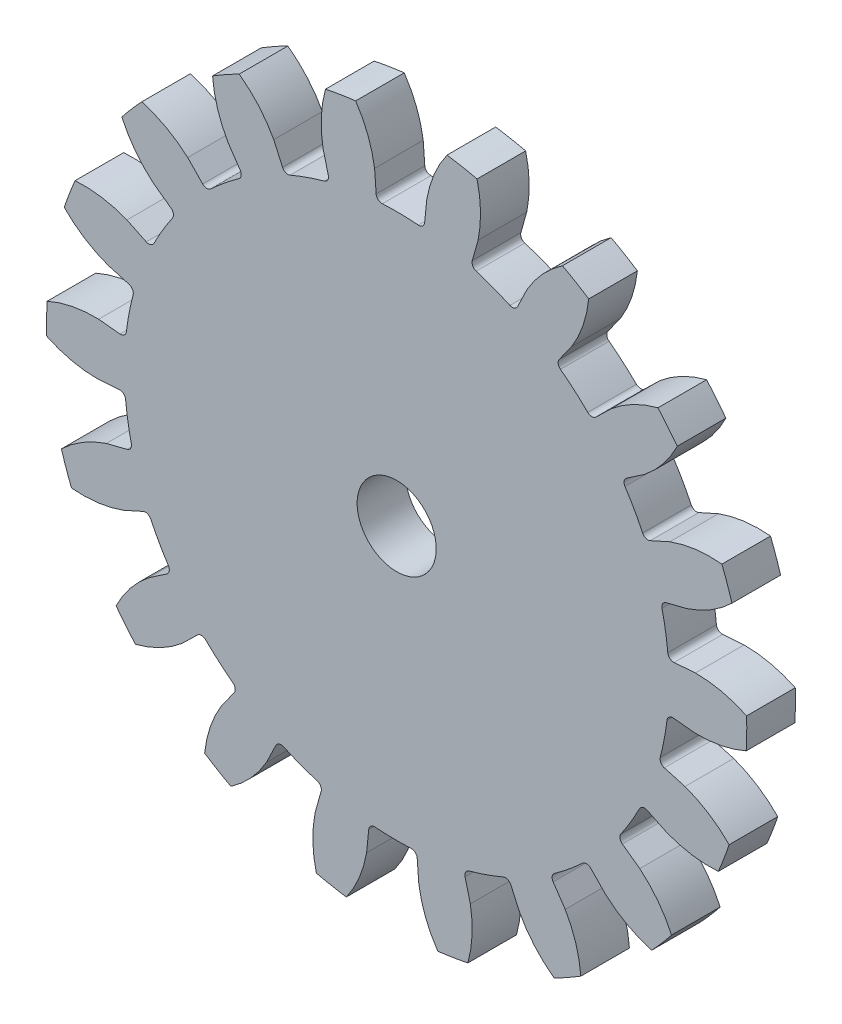
from build123d import *

# Parameters (mm, degrees)
BOSS_EXTRUDE1_DEPTH      = 3.175
FILLET1_R                = 0.381
CIRPATTERN1_COUNT        = 18
CIRPATTERN1_ANGLE        = 340
FILLET1_OF_CIRPATTERN1_R = 0.381
SKETCH2_R                = 2.5828
CUT_EXTRUDE1_DEPTH       = 33.368422922


with BuildPart() as part:
    # Sketch1 → Boss-Extrude1 (new body)
    with BuildSketch(Plane.XY):
        with BuildLine():
            Line((17.834748515, 8.02727285), (16.213407741, 7.297520773))
            ThreePointArc((16.213407741, 7.297520773), (15.879662784, 7.997794063), (15.515689986, 8.682843098))
            Line((15.515689986, 8.682843098), (0, 0))
            Line((0, 0), (17.549686627, 2.852525073))
            ThreePointArc((17.549686627, 2.852525073), (17.408557818, 3.615316681), (17.23429083, 4.371226327))
            Line((17.23429083, 4.371226327), (18.957719912, 4.80834896))
            ThreePointArc((18.957719912, 4.80834896), (20.523535103, 5.528199732), (21.888512952, 6.580244321))
            ThreePointArc((21.888512952, 6.580244321), (21.580653712, 7.528744912), (21.23171447, 8.462914109))
            ThreePointArc((21.23171447, 8.462914109), (19.508542384, 8.437609818), (17.834748515, 8.02727285))
        make_face()
    boss_extrude1 = extrude(amount=BOSS_EXTRUDE1_DEPTH)

    # Fillet1
    fillet1_edges = [part.edges().sort_by_distance(p)[0] for p in [
        (16.213407741, 7.297520773, 1.5875),
        (17.23429083, 4.371226327, 1.5875),
    ]]
    fillet(fillet1_edges, radius=FILLET1_R)

    # CirPattern1: Boss-Extrude1 ×18 about axis
    cirpattern1_axis = Axis((0, 0, 0), (0, 0, -1))
    for i in range(1, CIRPATTERN1_COUNT):
        add(boss_extrude1.rotate(cirpattern1_axis, i * CIRPATTERN1_ANGLE / (CIRPATTERN1_COUNT - 1)))

    # Fillet1 of CirPattern1
    fillet1_of_cirpattern1_edges = [part.edges().sort_by_distance(p)[0] for p in [
        (17.731518712, 1.312114381, 1.5875),
        (17.689983372, -1.786865496, 1.5875),
        (17.110946838, -4.83155237, 1.5875),
        (16.012002843, -7.729434969, 1.5875),
        (14.426542245, -10.392462599, 1.5875),
        (12.40273846, -12.739720511, 1.5875),
        (10.002083743, -14.699888462, 1.5875),
        (7.297520773, -16.213407741, 1.5875),
        (4.371226327, -17.23429083, 1.5875),
        (1.312114381, -17.731518712, 1.5875),
        (-1.786865496, -17.689983372, 1.5875),
        (-4.83155237, -17.110946838, 1.5875),
        (-7.729434969, -16.012002843, 1.5875),
        (-10.392462599, -14.426542245, 1.5875),
        (-12.739720511, -12.40273846, 1.5875),
        (-14.699888462, -10.002083743, 1.5875),
        (-16.213407741, -7.297520773, 1.5875),
        (-17.23429083, -4.371226327, 1.5875),
        (-17.731518712, -1.312114381, 1.5875),
        (-17.689983372, 1.786865496, 1.5875),
        (-17.110946838, 4.83155237, 1.5875),
        (-16.012002843, 7.729434969, 1.5875),
        (-14.426542245, 10.392462599, 1.5875),
        (-12.40273846, 12.739720511, 1.5875),
        (-10.002083743, 14.699888462, 1.5875),
        (-7.297520773, 16.213407741, 1.5875),
        (-4.371226327, 17.23429083, 1.5875),
        (-1.312114381, 17.731518712, 1.5875),
        (1.786865496, 17.689983372, 1.5875),
        (4.83155237, 17.110946838, 1.5875),
        (7.729434969, 16.012002843, 1.5875),
        (10.392462599, 14.426542245, 1.5875),
        (12.739720511, 12.40273846, 1.5875),
        (14.699888462, 10.002083743, 1.5875),
    ]]
    fillet(fillet1_of_cirpattern1_edges, radius=FILLET1_OF_CIRPATTERN1_R)

    # Sketch2 → Cut-Extrude1 (cut, through all)
    with BuildSketch(Plane.XY.offset(3.175)):
        Circle(SKETCH2_R)
    extrude(amount=-CUT_EXTRUDE1_DEPTH, mode=Mode.SUBTRACT)


solid = part.part
